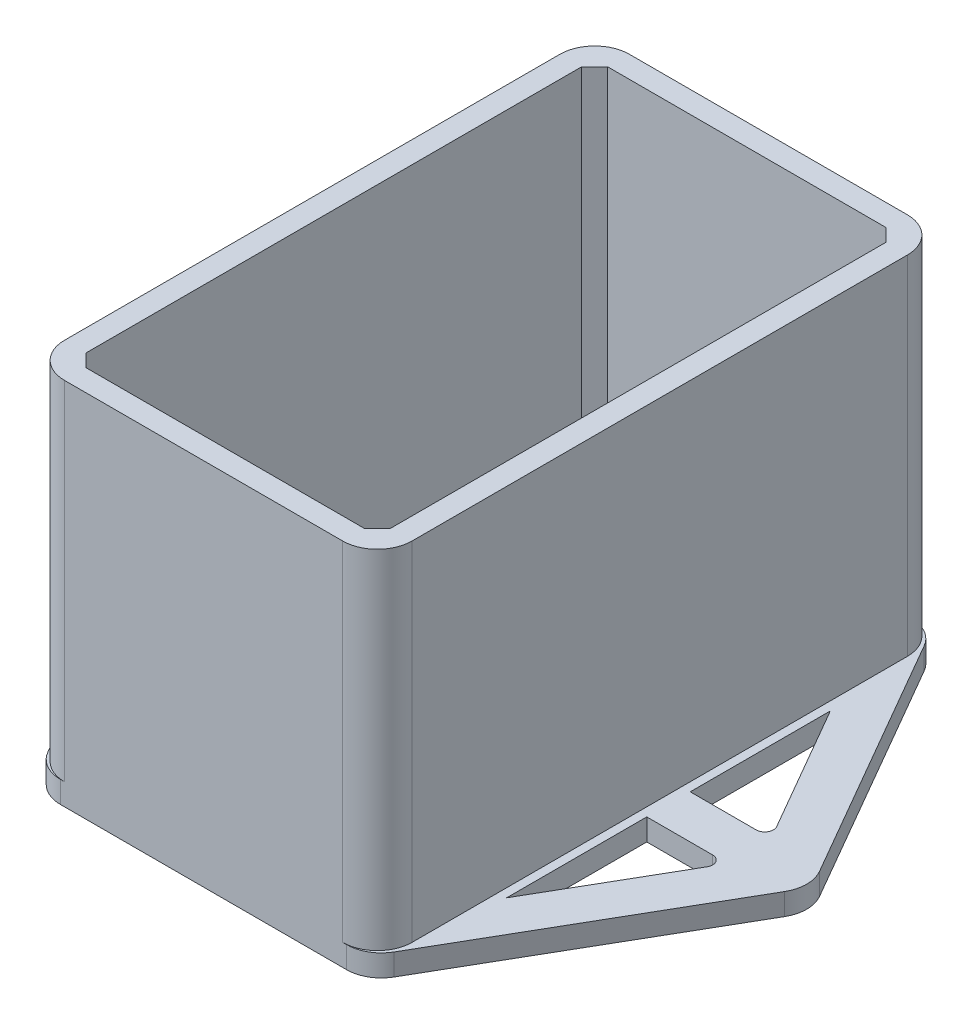
from build123d import *

# Parameters (mm, degrees)
BOSS_EXTRUDE1_DEPTH = 5
FILLET1_R           = 8
BOSS_EXTRUDE2_DEPTH = 80
CUT_EXTRUDE1_DEPTH  = 85
CUT_EXTRUDE2_DEPTH  = 5


with BuildPart() as part:
    # Sketch1 → Boss-Extrude1 (new body)
    with BuildSketch(Plane(origin=(0, 0, 0), x_dir=(1, 0, 0), z_dir=(0, 1, 0))):
        Polygon((-75.055534995, 0), (-37.527767497, -65), (37.527767497, -65), (75.055534995, 0), (37.527767497, 65), (-37.527767497, 65), align=None)
    extrude(amount=BOSS_EXTRUDE1_DEPTH)

    # Fillet1
    fillet1_edges = [part.edges().sort_by_distance(p)[0] for p in [
        (-37.527767497, 2.5, -65),
        (37.527767497, 2.5, -65),
        (75.055534995, 2.5, 0),
        (37.527767497, 2.5, 65),
        (-37.527767497, 2.5, 65),
        (-75.055534995, 2.5, 0),
    ]]
    fillet(fillet1_edges, radius=FILLET1_R)

    # Sketch3 → Boss-Extrude2 (add)
    with BuildSketch(Plane(origin=(0, 5, 0), x_dir=(1, 0, 0), z_dir=(0, 1, 0))):
        with BuildLine():
            Line((-32, 65), (32, 65))
            ThreePointArc((32, 65), (37.656854249, 62.656854249), (40, 57))
            Line((40, 57), (40, -57))
            ThreePointArc((40, -57), (37.656854249, -62.656854249), (32, -65))
            Line((32, -65), (-32, -65))
            ThreePointArc((-32, -65), (-37.656854249, -62.656854249), (-40, -57))
            Line((-40, -57), (-40, 57))
            ThreePointArc((-40, 57), (-37.656854249, 62.656854249), (-32, 65))
        make_face()
    extrude(amount=BOSS_EXTRUDE2_DEPTH)

    # Sketch4 → Cut-Extrude1 (cut)
    with BuildSketch(Plane(origin=(0, 85, 0), x_dir=(1, 0, 0), z_dir=(0, 1, 0))):
        Polygon((-35, 57), (-32, 60), (32, 60), (35, 57), (35, -57), (32, -60), (-32, -60), (-35, -57), align=None)
    extrude(amount=-CUT_EXTRUDE1_DEPTH, mode=Mode.SUBTRACT)

    # Sketch8 → Cut-Extrude2 (cut)
    with BuildSketch(Plane(origin=(0, 0, 0), x_dir=(1, 0, 0), z_dir=(0, 1, 0))):
        with BuildLine():
            ThreePointArc((58.889727457, 8), (58.889727457, 6), (57.15767665, 5))
            Line((57.15767665, 5), (42, 5))
            Line((42, 5), (42, 37.253866082))
            Line((42, 37.253866082), (58.889727457, 8))
        make_face()
        with BuildLine():
            Line((42, -37.253866082), (58.889727457, -8))
            ThreePointArc((58.889727457, -8), (58.889727457, -6), (57.15767665, -5))
            Line((57.15767665, -5), (42, -5))
            Line((42, -5), (42, -37.253866082))
        make_face()
        with BuildLine():
            ThreePointArc((-58.889727457, -8), (-58.889727457, -6), (-57.15767665, -5))
            Line((-57.15767665, -5), (-42, -5))
            Line((-42, -5), (-42, -37.253866082))
            Line((-42, -37.253866082), (-58.889727457, -8))
        make_face()
        with BuildLine():
            Line((-42, 37.253866082), (-58.889727457, 8))
            ThreePointArc((-58.889727457, 8), (-58.889727457, 6), (-57.15767665, 5))
            Line((-57.15767665, 5), (-42, 5))
            Line((-42, 5), (-42, 37.253866082))
        make_face()
    extrude(amount=CUT_EXTRUDE2_DEPTH, mode=Mode.SUBTRACT)


solid = part.part
